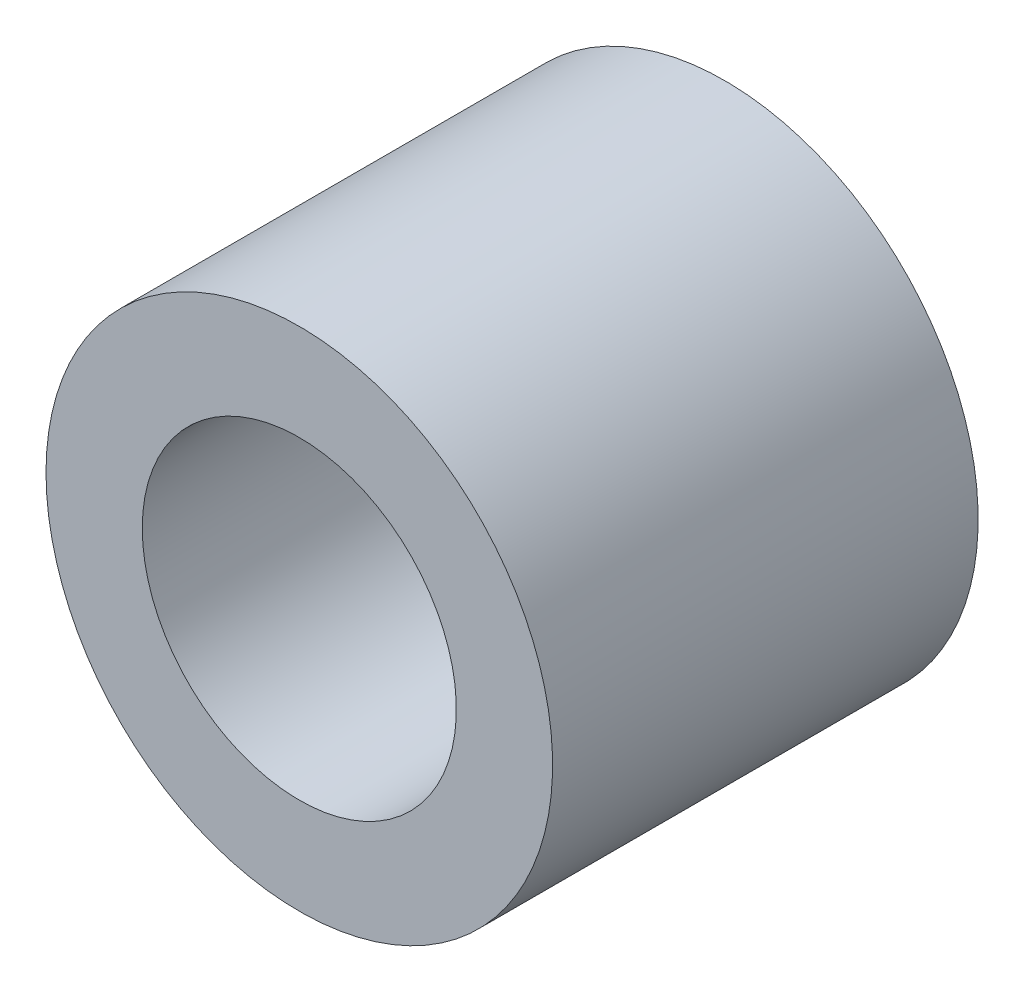
from build123d import *

# Parameters (mm, degrees)
ESBO_O1_R                = 2.5
ESBO_O1_R_2              = 1.55
RESSALTO_EXTRUS_O1_DEPTH = 4.2


with BuildPart() as part:
    # Esboço1 → Ressalto-extrusão1 (new body)
    with BuildSketch(Plane(origin=(0, 0, 3.7365107), x_dir=(-1, 0, 0), z_dir=(0, 0, -1))):
        with Locations((-11.723268008, -79.93921115)):
            Circle(ESBO_O1_R)
        with Locations((-11.723268008, -79.93921115)):
            Circle(ESBO_O1_R_2, mode=Mode.SUBTRACT)
    extrude(amount=RESSALTO_EXTRUS_O1_DEPTH)


solid = part.part
